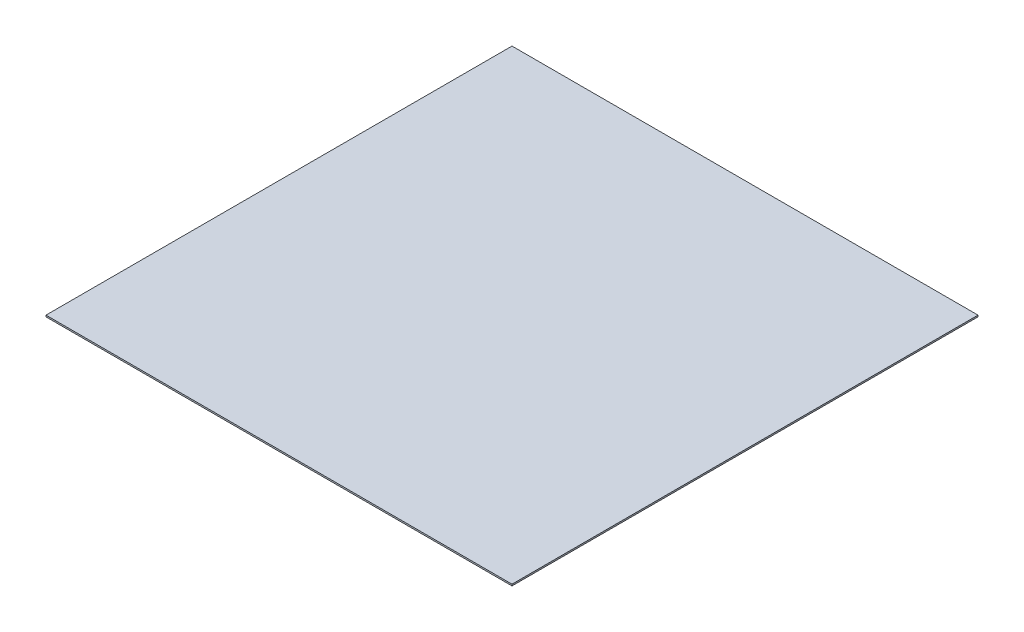
from build123d import *

# Parameters (mm, degrees)
SKETCH1_W           = 1500
SKETCH1_H           = 1500
BOSS_EXTRUDE1_DEPTH = 5


with BuildPart() as part:
    # Sketch1 → Boss-Extrude1 (new body)
    with BuildSketch(Plane(origin=(0, 0, 0), x_dir=(1, 0, 0), z_dir=(0, 1, 0))):
        Rectangle(SKETCH1_W, SKETCH1_H)
    extrude(amount=-BOSS_EXTRUDE1_DEPTH)


solid = part.part
